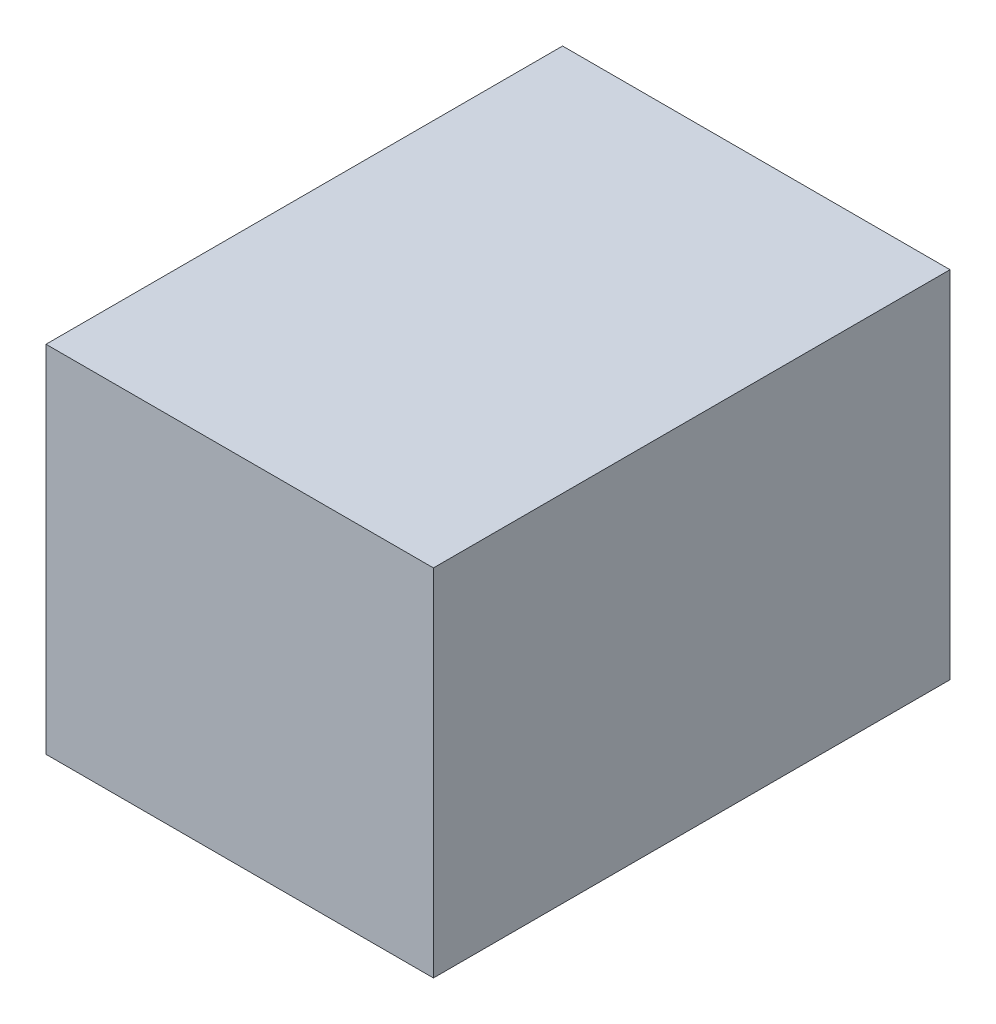
from build123d import *

# Parameters (mm, degrees)
SKETCH1_W           = 6
SKETCH1_H           = 8
BOSS_EXTRUDE1_DEPTH = 5.5


with BuildPart() as part:
    # Sketch1 → Boss-Extrude1 (new body)
    with BuildSketch(Plane(origin=(0, 0, 0), x_dir=(1, 0, 0), z_dir=(0, 1, 0))):
        with Locations((3, 4)):
            Rectangle(SKETCH1_W, SKETCH1_H)
    extrude(amount=BOSS_EXTRUDE1_DEPTH)


solid = part.part
